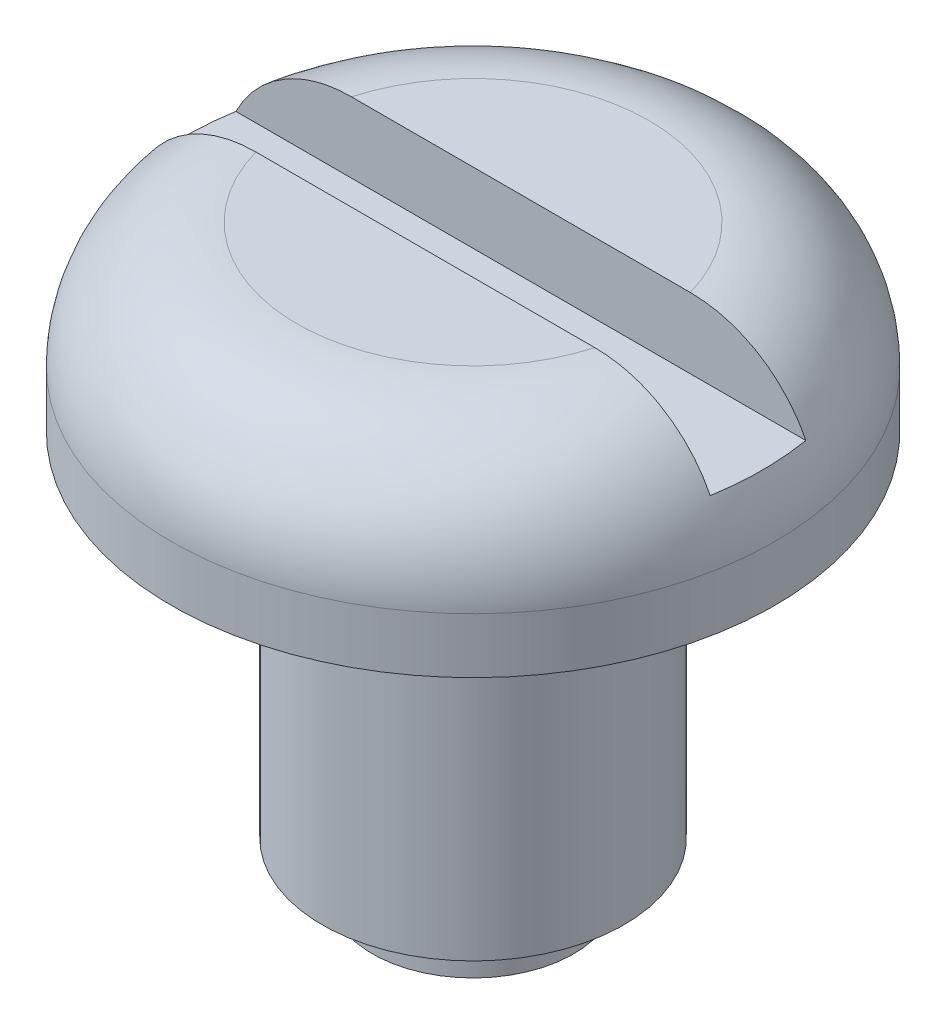
from build123d import *

# Parameters (mm, degrees)
CUT_EXTRUDE1_DEPTH      = 15.372195379
CUT_EXTRUDE1_DEPTH_BACK = 15.372195379
SKETCH2_W               = 1.9
SKETCH2_H               = 1.4


with BuildPart() as part:
    # Sketch1 → Revolve1 (revolve)
    with BuildSketch(Plane.XY, mode=Mode.PRIVATE) as revolve1_sk:
        with BuildLine():
            Line((0, 0), (-2, 0))
            Line((-2, 0), (-2, 1))
            Line((-2, 1), (-3, 1))
            Line((-3, 1), (-3, 8))
            Line((-3, 8), (-6, 8))
            Line((-6, 8), (-6, 9.1))
            ThreePointArc((-6, 9.1), (-5.267766953, 10.867766953), (-3.5, 11.6))
            Line((-3.5, 11.6), (0, 11.6))
            Line((0, 11.6), (0, 0))
        make_face()
    revolve(revolve1_sk.sketch.rotate(Axis((0, 0, 0), (0, 1, 0)), 270), axis=Axis((0, 0, 0), (0, 1, 0)))

    # Sketch2 → Cut-Extrude1 (cut, two sides: drawn at the far end of the back side and taken through both)
    with BuildSketch(Plane(origin=(0, 0, 0), x_dir=(0, 0, -1), z_dir=(1, 0, 0)).offset(-CUT_EXTRUDE1_DEPTH_BACK)):
        with Locations((0, 10.9)):
            Rectangle(SKETCH2_W, SKETCH2_H)
    extrude(amount=CUT_EXTRUDE1_DEPTH + CUT_EXTRUDE1_DEPTH_BACK, mode=Mode.SUBTRACT)


solid = part.part
